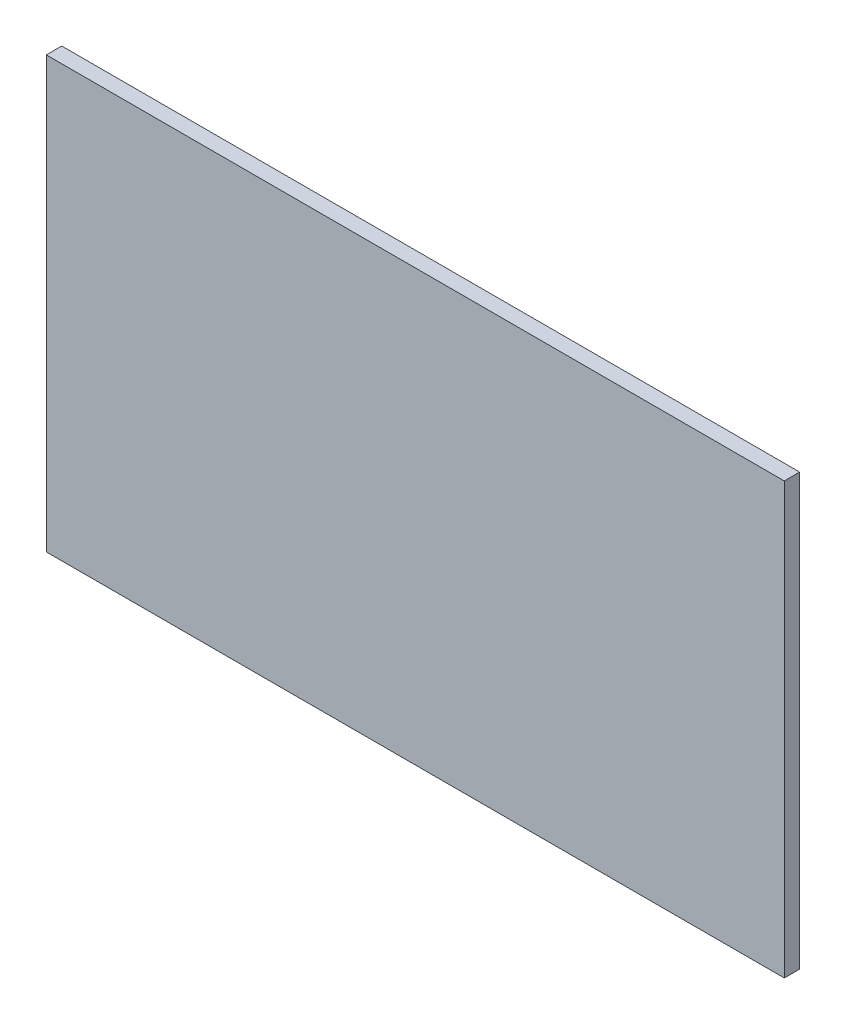
from build123d import *

# Parameters (mm, degrees)
SKETCH1_W           = 1440
SKETCH1_H           = 840
BOSS_EXTRUDE1_DEPTH = 30


with BuildPart() as part:
    # Sketch1 → Boss-Extrude1 (new body)
    with BuildSketch(Plane.XY):
        with Locations((720, 420)):
            Rectangle(SKETCH1_W, SKETCH1_H)
    extrude(amount=BOSS_EXTRUDE1_DEPTH)


solid = part.part
